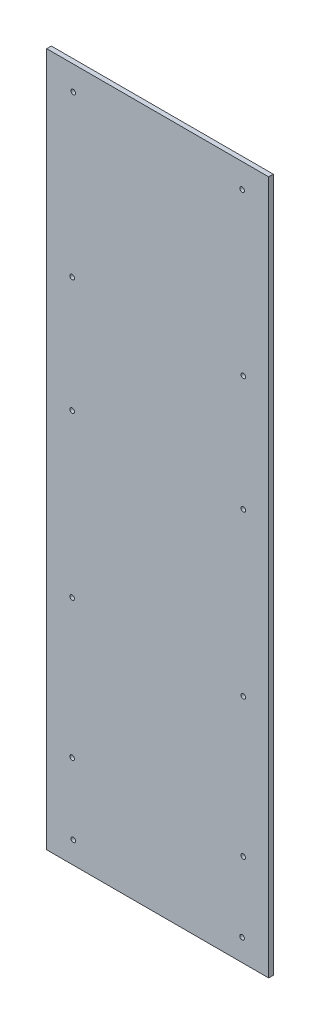
from build123d import *

# Parameters (mm, degrees)
SKETCH1_W           = 96
SKETCH1_H           = 300
BOSS_EXTRUDE1_DEPTH = 2
SKETCH2_R           = 1
CUT_EXTRUDE1_DEPTH  = 10
SKETCH3_R           = 1
CUT_EXTRUDE2_DEPTH  = 10


with BuildPart() as part:
    # Sketch1 → Boss-Extrude1 (new body)
    with BuildSketch(Plane.XY):
        Rectangle(SKETCH1_W, SKETCH1_H)
    extrude(amount=BOSS_EXTRUDE1_DEPTH)

    # Sketch2 → Cut-Extrude1 (cut)
    with BuildSketch(Plane.XY.offset(2)):
        with Locations((-37, 70)):
            Circle(SKETCH2_R)
        with Locations((-37, 20)):
            Circle(SKETCH2_R)
        with Locations((-37, -110)):
            Circle(SKETCH2_R)
        with Locations((-37, -50)):
            Circle(SKETCH2_R)
        with Locations((37, 70)):
            Circle(SKETCH2_R)
        with Locations((37, 20)):
            Circle(SKETCH2_R)
        with Locations((37, -50)):
            Circle(SKETCH2_R)
        with Locations((37, -110)):
            Circle(SKETCH2_R)
    extrude(amount=-CUT_EXTRUDE1_DEPTH, mode=Mode.SUBTRACT)

    # Sketch3 → Cut-Extrude2 (cut)
    with BuildSketch(Plane.XY.offset(2)):
        with Locations((-36.5, 139.5)):
            Circle(SKETCH3_R)
        with Locations((36.5, 139.5)):
            Circle(SKETCH3_R)
        with Locations((-36.5, -140.5)):
            Circle(SKETCH3_R)
        with Locations((36.5, -140.5)):
            Circle(SKETCH3_R)
    extrude(amount=-CUT_EXTRUDE2_DEPTH, mode=Mode.SUBTRACT)


solid = part.part
